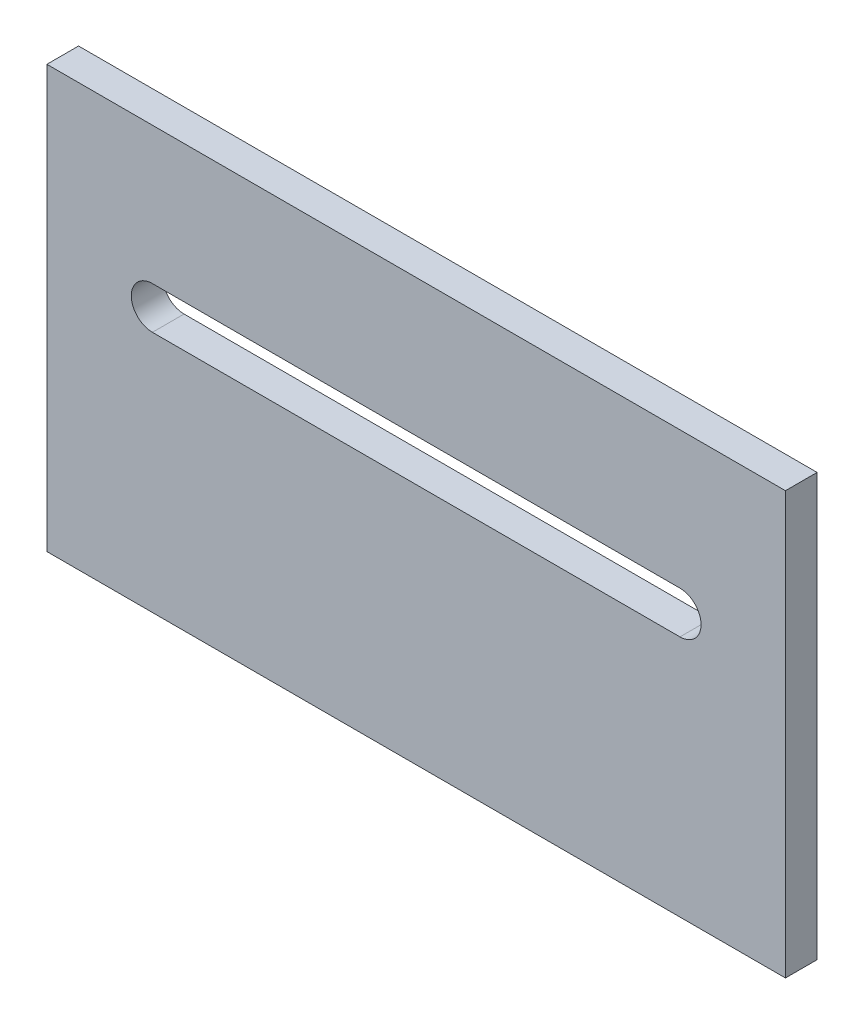
from build123d import *

# Parameters (mm, degrees)
SKETCH1_W           = 70
SKETCH1_H           = 40
BOSS_EXTRUDE1_DEPTH = 3
CUT_EXTRUDE1_DEPTH  = 3


with BuildPart() as part:
    # Sketch1 → Boss-Extrude1 (new body)
    with BuildSketch(Plane.XY):
        with Locations((35, -20)):
            Rectangle(SKETCH1_W, SKETCH1_H)
    extrude(amount=BOSS_EXTRUDE1_DEPTH)

    # Sketch2 → Cut-Extrude1 (cut)
    with BuildSketch(Plane.XY.offset(3)):
        with BuildLine():
            Line((10, -13), (60, -13))
            ThreePointArc((60, -13), (62, -15), (60, -17))
            Line((60, -17), (10, -17))
            ThreePointArc((10, -17), (8, -15), (10, -13))
        make_face()
    extrude(amount=-CUT_EXTRUDE1_DEPTH, mode=Mode.SUBTRACT)


solid = part.part
